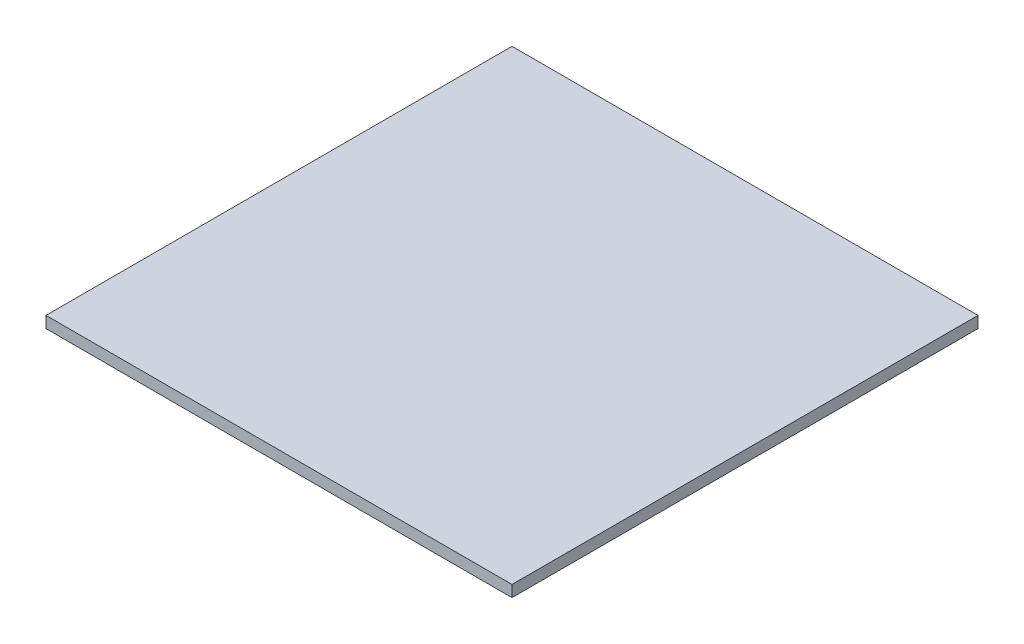
from build123d import *

# Parameters (mm, degrees)
SKETCH1_W           = 122
SKETCH1_H           = 122
BOSS_EXTRUDE1_DEPTH = 3


with BuildPart() as part:
    # Sketch1 → Boss-Extrude1 (new body)
    with BuildSketch(Plane(origin=(0, 0, 0), x_dir=(1, 0, 0), z_dir=(0, 1, 0))):
        Rectangle(SKETCH1_W, SKETCH1_H)
    extrude(amount=BOSS_EXTRUDE1_DEPTH)


solid = part.part
